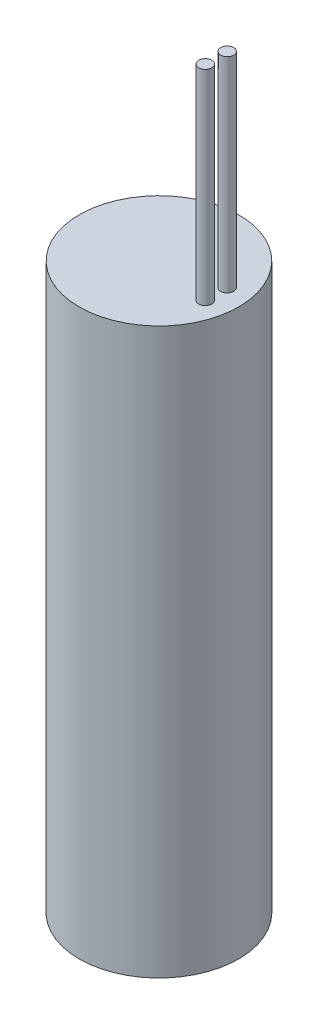
from build123d import *

# Parameters (mm, degrees)
SKETCH1_R           = 9.75
BOSS_EXTRUDE1_DEPTH = 69
SKETCH2_R           = 0.8
BOSS_EXTRUDE2_DEPTH = 25


with BuildPart() as part:
    # Sketch1 → Boss-Extrude1 (new body)
    with BuildSketch(Plane(origin=(0, 0, 0), x_dir=(1, 0, 0), z_dir=(0, 1, 0))):
        with Locations(Location((0, 0, 0), (0, 0, 270))):
            Circle(SKETCH1_R)
    extrude(amount=BOSS_EXTRUDE1_DEPTH)

    # Sketch2 → Boss-Extrude2 (add)
    with BuildSketch(Plane(origin=(0, 69, 0), x_dir=(1, 0, 0), z_dir=(0, 1, 0))):
        with Locations(Location((7, 1.337997216, 0), (0, 0, 270))):
            Circle(SKETCH2_R)
        with Locations(Location((7, -1.337997216, 0), (0, 0, 270))):
            Circle(SKETCH2_R)
    extrude(amount=BOSS_EXTRUDE2_DEPTH)


solid = part.part
